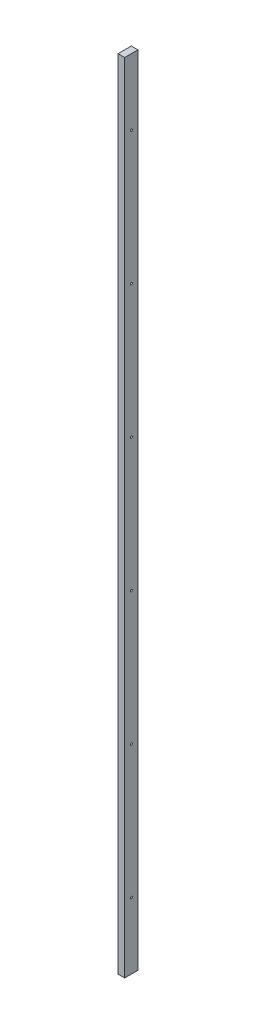
from build123d import *

# Parameters (mm, degrees)
SKETCH_1_W          = 25
SKETCH_1_H          = 50
EXTRUDE_1_DEPTH     = 3000
SKETCH_2_R          = 4
CUT_EXTRUDE_1_DEPTH = 100


with BuildPart() as part:
    # Эскиз1 → Бобышка-Вытянуть1 (new body)
    with BuildSketch(Plane(origin=(0, 0, 0), x_dir=(1, 0, 0), z_dir=(0, 1, 0))):
        Rectangle(SKETCH_1_W, SKETCH_1_H)
    extrude(amount=EXTRUDE_1_DEPTH)

    # Эскиз2 → Вырез-Вытянуть1 (cut)
    with BuildSketch(Plane(origin=(12.5, 0, 0), x_dir=(0, 0, -1), z_dir=(1, 0, 0))):
        with Locations((0, 250)):
            Circle(SKETCH_2_R)
        with Locations((0, 750)):
            Circle(SKETCH_2_R)
        with Locations((0, 1250)):
            Circle(SKETCH_2_R)
        with Locations((0, 1750)):
            Circle(SKETCH_2_R)
        with Locations((0, 2750)):
            Circle(SKETCH_2_R)
        with Locations((0, 2250)):
            Circle(SKETCH_2_R)
    extrude(amount=-CUT_EXTRUDE_1_DEPTH, mode=Mode.SUBTRACT)


solid = part.part
